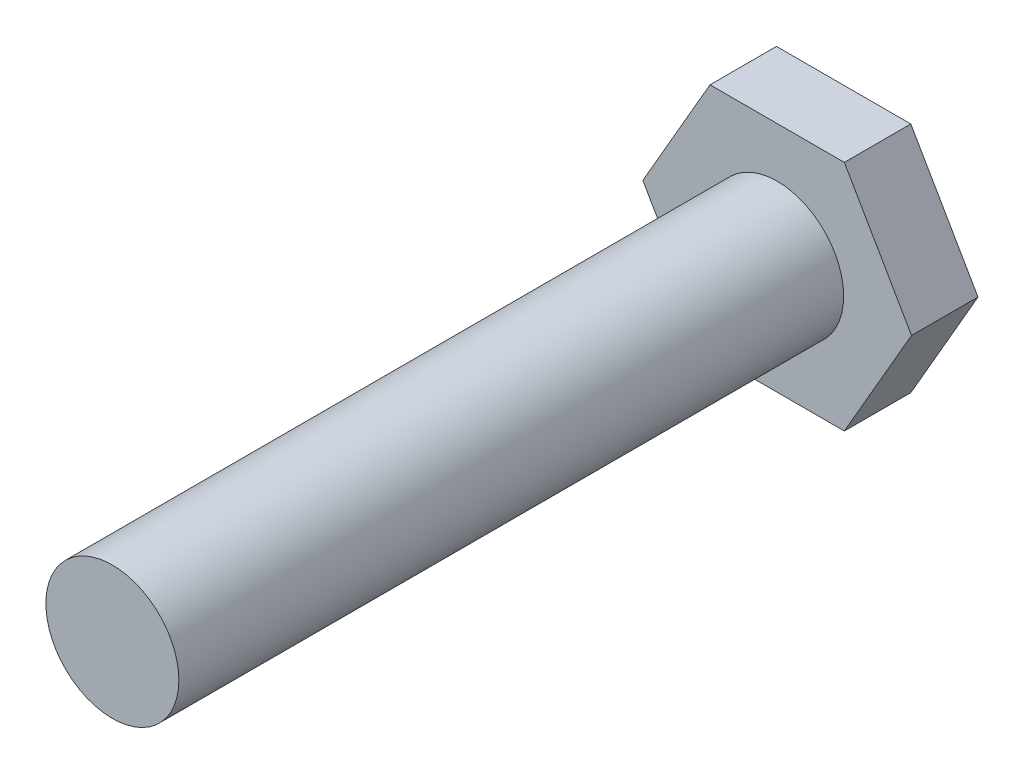
from build123d import *

# Parameters (mm, degrees)
SKETCH1_R           = 10
BOSS_EXTRUDE1_DEPTH = 100
BOSS_EXTRUDE2_DEPTH = 10


with BuildPart() as part:
    # Sketch1 → Boss-Extrude1 (new body)
    with BuildSketch(Plane.XY):
        Circle(SKETCH1_R)
    extrude(amount=BOSS_EXTRUDE1_DEPTH)

    # Sketch3 → Boss-Extrude2 (add)
    with BuildSketch(Plane(origin=(0, 0, 0), x_dir=(-1, 0, 0), z_dir=(0, 0, -1))):
        Polygon((20.207259422, 0), (10.103629711, 17.5), (-10.103629711, 17.5), (-20.207259422, 0), (-10.103629711, -17.5), (10.103629711, -17.5), align=None)
    extrude(amount=BOSS_EXTRUDE2_DEPTH)


solid = part.part
